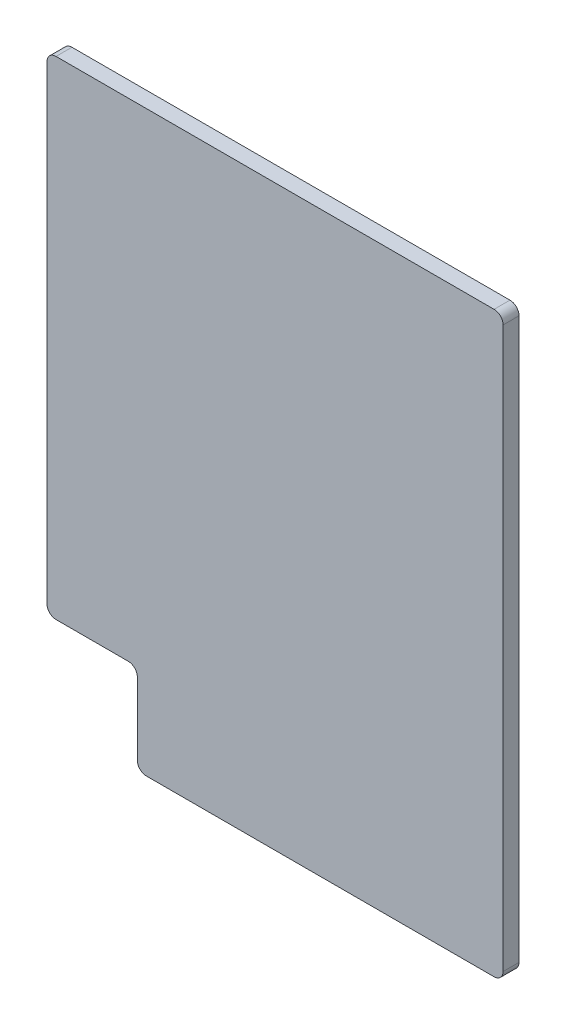
from build123d import *

# Parameters (mm, degrees)
BOSS_EXTRUDE1_DEPTH = 5.588
FILLET1_R           = 3.175


with BuildPart() as part:
    # Sketch1 → Boss-Extrude1 (new body)
    with BuildSketch(Plane.XY):
        Polygon((31.75, 31.75), (31.75, 0), (160.3375, 0), (160.3375, 203.2), (0, 203.2), (0, 31.75), align=None)
    extrude(amount=BOSS_EXTRUDE1_DEPTH)

    # Fillet1
    fillet1_edges = [part.edges().sort_by_distance(p)[0] for p in [
        (31.75, 31.75, 2.794),
        (0, 31.75, 2.794),
        (0, 203.2, 2.794),
        (160.3375, 203.2, 2.794),
        (160.3375, 0, 2.794),
        (31.75, 0, 2.794),
    ]]
    fillet(fillet1_edges, radius=FILLET1_R)


solid = part.part
